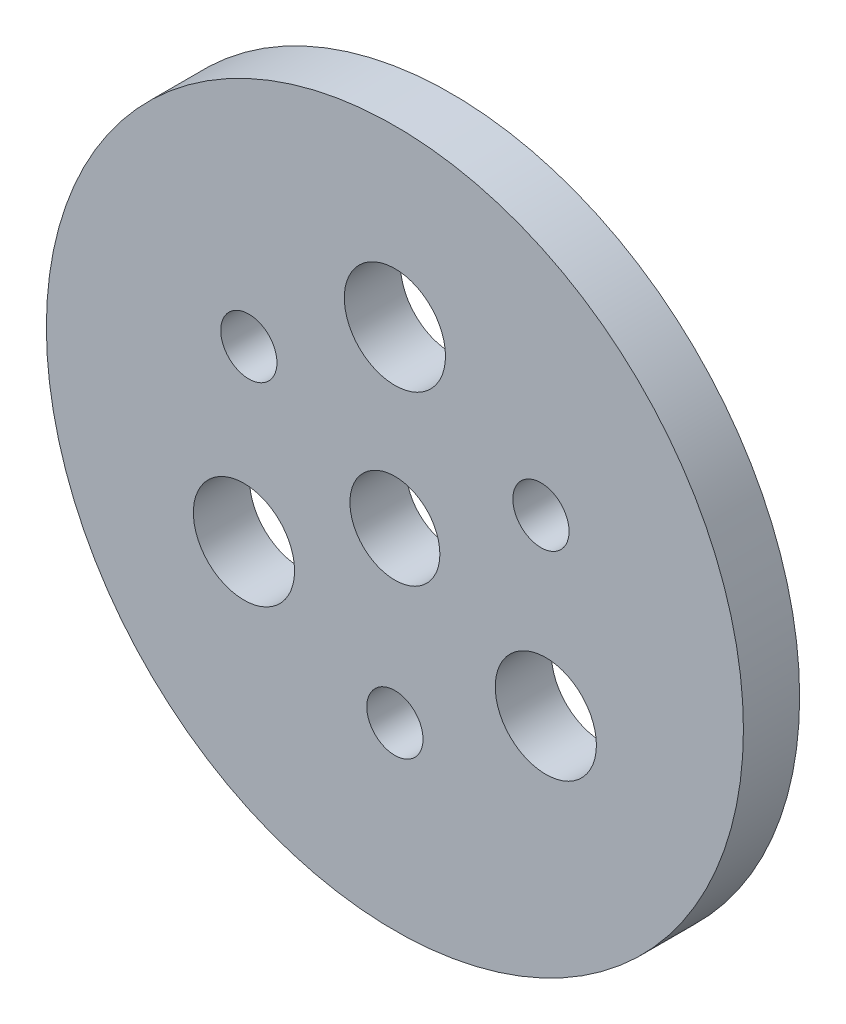
from build123d import *

# Parameters (mm, degrees)
SKETCH1_R           = 31
SKETCH1_R_2         = 4
SKETCH1_R_3         = 2.5
SKETCH1_R_4         = 4.5
BOSS_EXTRUDE1_DEPTH = 5


with BuildPart() as part:
    # Sketch1 → Boss-Extrude1 (new body)
    with BuildSketch(Plane.XY):
        Circle(SKETCH1_R)
        Circle(SKETCH1_R_2, mode=Mode.SUBTRACT)
        with Locations((0, -15)):
            Circle(SKETCH1_R_3, mode=Mode.SUBTRACT)
        with Locations((-12.990381057, 7.5)):
            Circle(SKETCH1_R_3, mode=Mode.SUBTRACT)
        with Locations((12.990381057, 7.5)):
            Circle(SKETCH1_R_3, mode=Mode.SUBTRACT)
        with Locations((0, 15.5)):
            Circle(SKETCH1_R_4, mode=Mode.SUBTRACT)
        with Locations((13.423393759, -7.75)):
            Circle(SKETCH1_R_4, mode=Mode.SUBTRACT)
        with Locations((-13.423393759, -7.75)):
            Circle(SKETCH1_R_4, mode=Mode.SUBTRACT)
    extrude(amount=BOSS_EXTRUDE1_DEPTH)


solid = part.part
